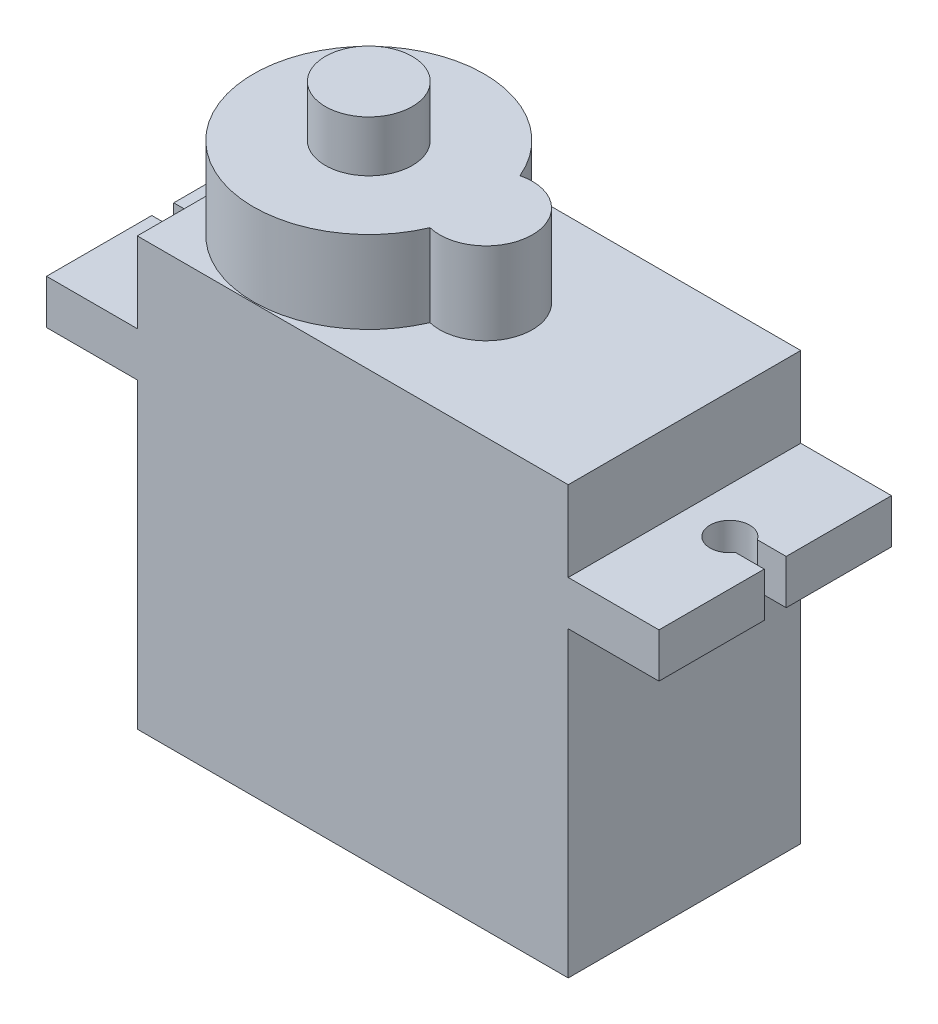
from build123d import *

# Parameters (mm, degrees)
ESBO_O1_W                = 22.8
ESBO_O1_H                = 12.3
RESSALTO_EXTRUS_O1_DEPTH = 16
ESBO_O2_W                = 32.4
ESBO_O2_H                = 12.3
RESSALTO_EXTRUS_O2_DEPTH = 2.35
ESBO_O3_W                = 22.8
ESBO_O3_H                = 12.3
RESSALTO_EXTRUS_O3_DEPTH = 4.25
CORTE_EXTRUS_O1_DEPTH    = 4.25
RESSALTO_EXTRUS_O4_DEPTH = 4.35
ESBO_O6_R                = 2.3
RESSALTO_EXTRUS_O5_DEPTH = 2.7


with BuildPart() as part:
    # Esboço1 → Ressalto-extrusão1 (new body)
    with BuildSketch(Plane(origin=(0, 0, 0), x_dir=(1, 0, 0), z_dir=(0, 1, 0))):
        Rectangle(ESBO_O1_W, ESBO_O1_H)
    extrude(amount=RESSALTO_EXTRUS_O1_DEPTH)

    # Esboço2 → Ressalto-extrusão2 (add)
    with BuildSketch(Plane(origin=(0, 16, 0), x_dir=(1, 0, 0), z_dir=(0, 1, 0))):
        Rectangle(ESBO_O2_W, ESBO_O2_H)
    extrude(amount=RESSALTO_EXTRUS_O2_DEPTH)

    # Esboço3 → Ressalto-extrusão3 (add)
    with BuildSketch(Plane(origin=(0, 18.35, 0), x_dir=(-1, 0, 0), z_dir=(0, 1, 0))):
        Rectangle(ESBO_O3_W, ESBO_O3_H)
    extrude(amount=RESSALTO_EXTRUS_O3_DEPTH)

    # Esboço4 → Corte-extrusão1 (cut)
    with BuildSketch(Plane(origin=(0, 18.35, 0), x_dir=(1, 0, 0), z_dir=(0, 1, 0))):
        with BuildLine():
            Line((16.2, 0), (16.2, 0.58))
            Line((16.2, 0.58), (14.675271386, 0.58))
            ThreePointArc((14.675271386, 0.58), (12.75, 0), (14.675271386, -0.58))
            Line((14.675271386, -0.58), (16.2, -0.58))
            Line((16.2, -0.58), (16.2, 0))
        make_face()
        with BuildLine():
            Line((-16.2, 0.58), (-14.675271386, 0.58))
            ThreePointArc((-14.675271386, 0.58), (-12.75, 0), (-14.675271386, -0.58))
            Line((-14.675271386, -0.58), (-16.2, -0.58))
            Line((-16.2, -0.58), (-16.2, 0))
            Line((-16.2, 0), (-16.2, 0.58))
        make_face()
    extrude(amount=-CORTE_EXTRUS_O1_DEPTH, mode=Mode.SUBTRACT)

    # Esboço5 → Ressalto-extrusão4 (add)
    with BuildSketch(Plane(origin=(0, 22.6, 0), x_dir=(1, 0, 0), z_dir=(0, 1, 0))):
        with BuildLine():
            ThreePointArc((0.315959416, 2.381386118), (-11.4, 0), (0.315959416, -2.381386118))
            ThreePointArc((0.315959416, -2.381386118), (3.351959063, 0), (0.315959416, 2.381386118))
        make_face()
    extrude(amount=RESSALTO_EXTRUS_O4_DEPTH)

    # Esboço6 → Ressalto-extrusão5 (add)
    with BuildSketch(Plane(origin=(0, 26.95, 0), x_dir=(1, 0, 0), z_dir=(0, 1, 0))):
        with Locations(Location((-5.3, 0, 0), (0, 0, 90))):
            Circle(ESBO_O6_R)
    extrude(amount=RESSALTO_EXTRUS_O5_DEPTH)


solid = part.part
